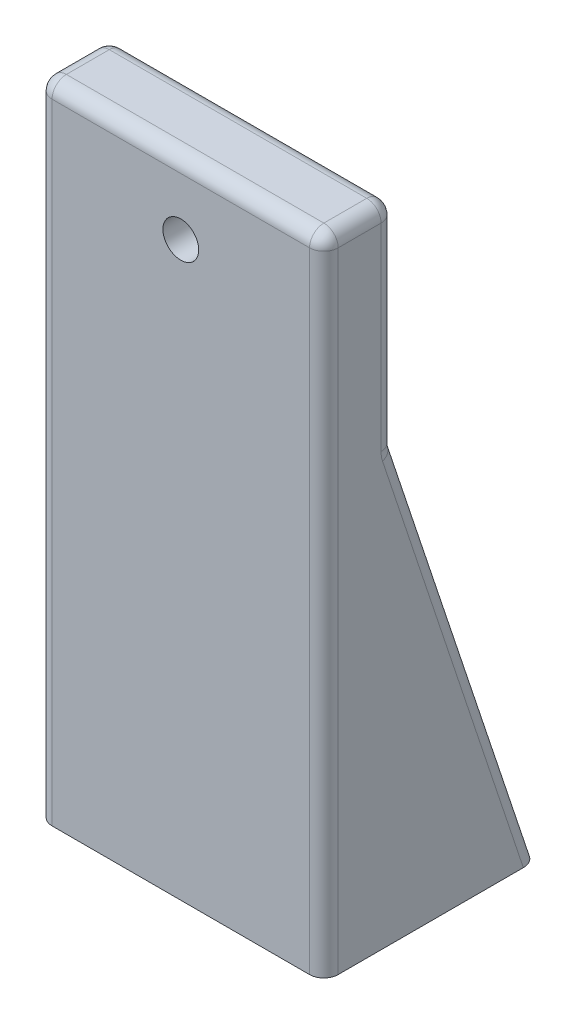
from build123d import *

# Parameters (mm, degrees)
SKETCH1_W           = 50.8
SKETCH1_H           = 114.3
SKETCH1_R           = 3.175
BOSS_EXTRUDE1_DEPTH = 6.35
BOSS_EXTRUDE2_DEPTH = 50.8
SKETCH2_R           = 1.5
CUT_EXTRUDE1_DEPTH  = 12.7
FILLET1_R           = 2.54


with BuildPart() as part:
    # Sketch1 → Boss-Extrude1 (new, symmetric)
    with BuildSketch(Plane.XY):
        Rectangle(SKETCH1_W, SKETCH1_H)
        with Locations((0, 44.45)):
            Circle(SKETCH1_R, mode=Mode.SUBTRACT)
    extrude(amount=BOSS_EXTRUDE1_DEPTH, both=True)

    # Sketch3 → Boss-Extrude2 (add, through all)
    with BuildSketch(Plane(origin=(25.4, 0, 0), x_dir=(0, 0, -1), z_dir=(1, 0, 0))):
        Polygon((6.35, -57.15), (31.75, -57.15), (6.35, 19.05), align=None)
    extrude(amount=-BOSS_EXTRUDE2_DEPTH)

    # Sketch2 → Cut-Extrude1 (cut)
    with BuildSketch(Plane.XZ.offset(57.15)):
        with Locations(Location((-15.24, 0, 0), (0, 0, 270))):
            Circle(SKETCH2_R)
        with Locations(Location((15.24, 0, 0), (0, 0, 270))):
            Circle(SKETCH2_R)
        with Locations(Location((-15.24, -22.86, 0), (0, 0, 270))):
            Circle(SKETCH2_R)
        with Locations(Location((15.24, -22.86, 0), (0, 0, 270))):
            Circle(SKETCH2_R)
    extrude(amount=-CUT_EXTRUDE1_DEPTH, mode=Mode.SUBTRACT)

    # Fillet1
    fillet1_edges = [part.edges().sort_by_distance(p)[0] for p in [
        (-25.4, 0, 6.35),
        (25.4, 38.1, -6.35),
        (-25.4, -19.05, -19.05),
        (0, 19.05, -6.35),
        (25.4, -19.05, -19.05),
        (25.4, 0, 6.35),
        (-25.4, 38.1, -6.35),
        (0, 57.15, -6.35),
        (-25.4, 57.15, 0),
        (25.4, 57.15, 0),
        (0, 57.15, 6.35),
    ]]
    fillet(fillet1_edges, radius=FILLET1_R)


solid = part.part
